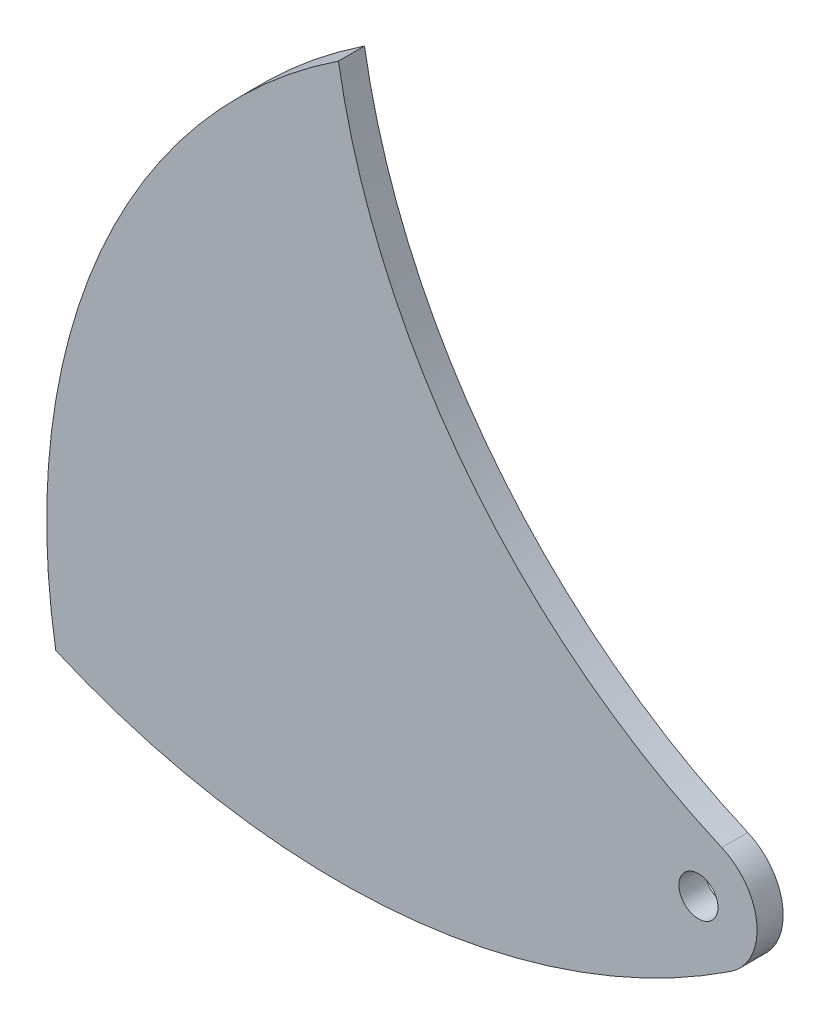
from build123d import *

# Parameters (mm, degrees)
SKETCH1_R           = 0.75
BOSS_EXTRUDE1_DEPTH = 1


with BuildPart() as part:
    # Sketch1 → Boss-Extrude1 (new body)
    with BuildSketch(Plane.XY):
        with BuildLine():
            ThreePointArc((1.242798515, -1.875620391), (2.241296995, 0.197706303), (0.89526255, 2.064220183))
            ThreePointArc((0.89526255, 2.064220183), (-8.839978566, 9.585878309), (-13.808872387, 20.840226568))
            ThreePointArc((-13.808872387, 20.840226568), (-22.935779817, 9.947361671), (-24.651496608, -4.159773432))
            ThreePointArc((-24.651496608, -4.159773432), (-11.414429389, -6.304370366), (1.242798515, -1.875620391))
        make_face()
        Circle(SKETCH1_R, mode=Mode.SUBTRACT)
    extrude(amount=BOSS_EXTRUDE1_DEPTH)


solid = part.part
